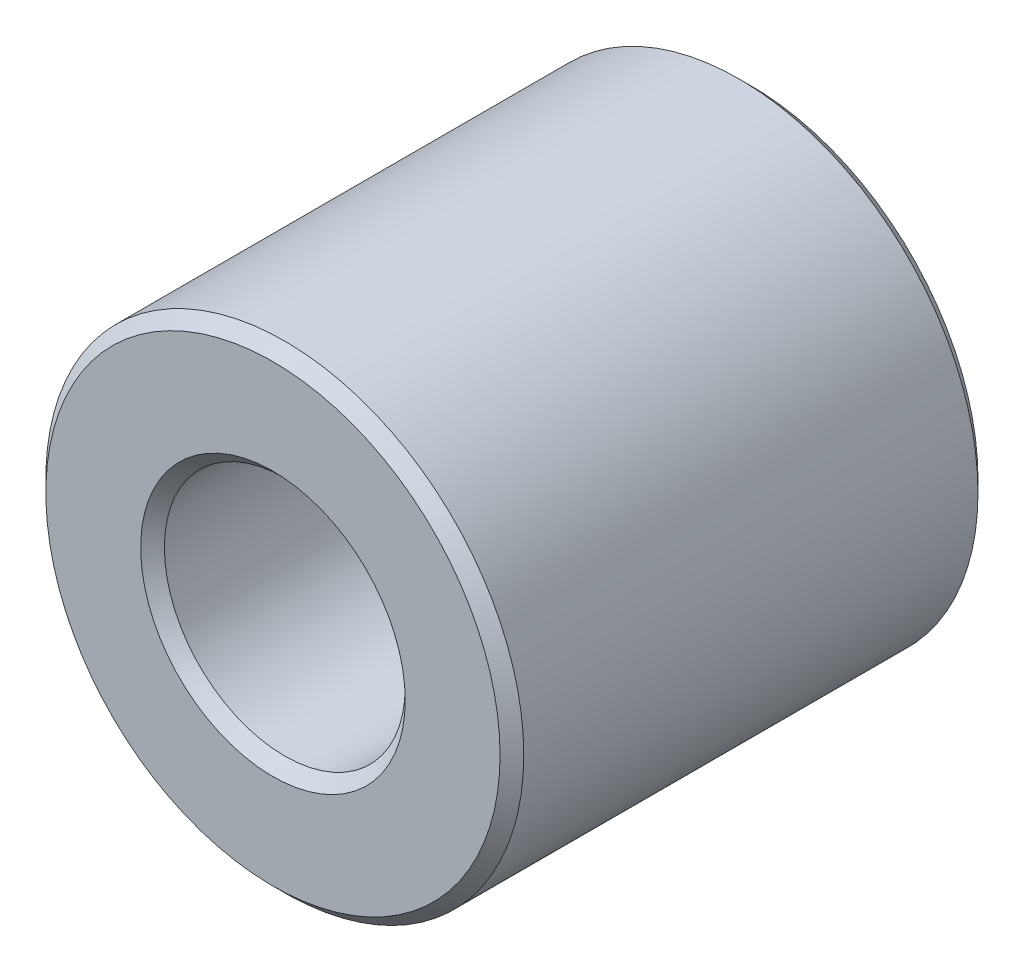
from build123d import *

# Parameters (mm, degrees)
BOSS_EXTRUDE1_DEPTH      = 6.35
BOSS_EXTRUDE1_DEPTH_BACK = 6.35
SKETCH3_R                = 6.35
SKETCH3_R_2              = 3.2004
CHAMFER1_SIZE            = 0.31496


with BuildPart() as part:
    # Sketch3 → Boss-Extrude1 (new, two sides: drawn at the far end of the back side and taken through both)
    with BuildSketch(Plane.XY.offset(-BOSS_EXTRUDE1_DEPTH_BACK)):
        Circle(SKETCH3_R)
        Circle(SKETCH3_R_2, mode=Mode.SUBTRACT)
    extrude(amount=BOSS_EXTRUDE1_DEPTH + BOSS_EXTRUDE1_DEPTH_BACK)

    # Chamfer1
    chamfer1_edges = [part.edges().sort_by_distance(p)[0] for p in [
        (-6.35, 0, -6.35),
        (-3.2004, 0, -6.35),
        (-6.35, 0, 6.35),
        (-3.2004, 0, 6.35),
    ]]
    chamfer(chamfer1_edges, length=CHAMFER1_SIZE)


solid = part.part
